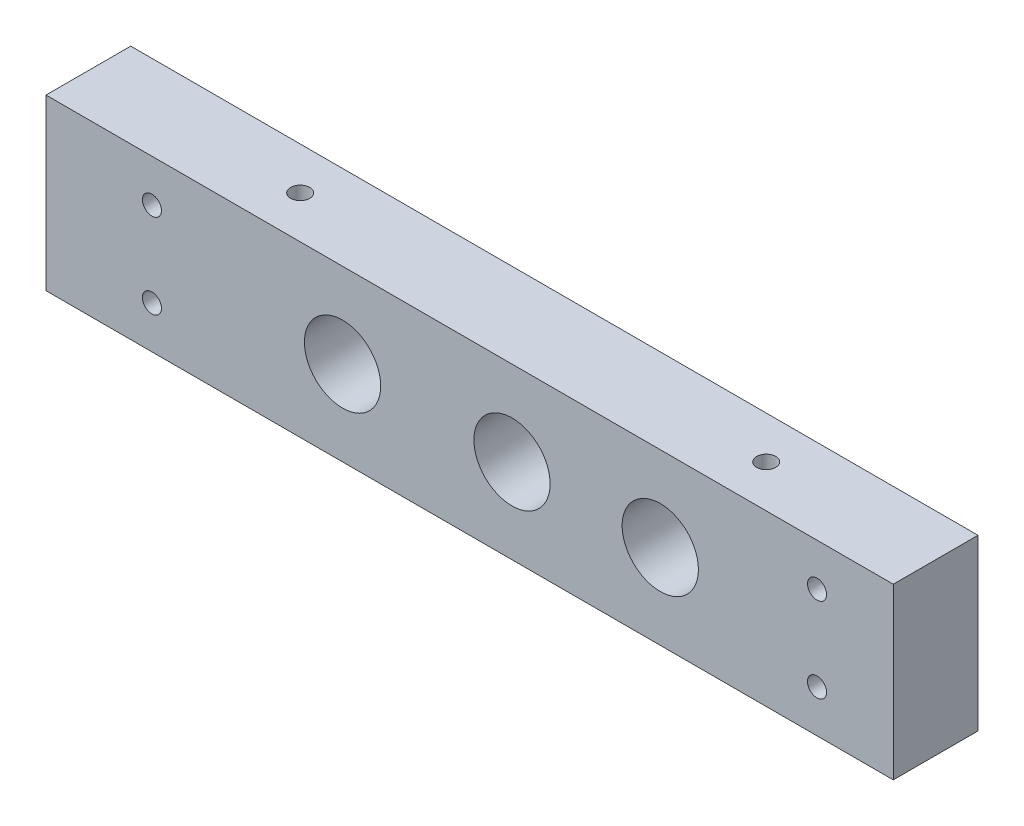
from build123d import *

# Parameters (mm, degrees)
F_200X40X20_START          = -10
SKETCH_1_W                 = 200
SKETCH_1_H                 = 40
F_200X40X20_DEPTH          = 20
CUT_EXTRUDE_321_DEPTH      = 202.246117975
CUT_EXTRUDE_321_DEPTH_BACK = 202.246117975
SKETCH_2_R                 = 9
SKETCH_2_R_2               = 2.25
CUT_EXTRUDE_M4_DEPTH       = 202.246117975
CUT_EXTRUDE_M4_DEPTH_BACK  = 202.246117975
SKETCH_3_R                 = 2.25


with BuildPart() as part:
    # 草图1 → 前臂200x40x20 (new body)
    with BuildSketch(Plane.XY.offset(F_200X40X20_START)):
        with Locations((100, 0)):
            Rectangle(SKETCH_1_W, SKETCH_1_H)
    extrude(amount=F_200X40X20_DEPTH)

    # 草图2 → Cut-Extrude 321 (cut, two sides: drawn at the far end of the back side and taken through both)
    with BuildSketch(Plane.XY.offset(-CUT_EXTRUDE_321_DEPTH_BACK)):
        with Locations((70, 0)):
            Circle(SKETCH_2_R)
        with Locations((110, 0)):
            Circle(SKETCH_2_R)
        with Locations((145, 0)):
            Circle(SKETCH_2_R)
        with Locations((25, -10)):
            Circle(SKETCH_2_R_2)
        with Locations((25, 10)):
            Circle(SKETCH_2_R_2)
        with Locations((182, -10)):
            Circle(SKETCH_2_R_2)
        with Locations((182, 10)):
            Circle(SKETCH_2_R_2)
    extrude(amount=CUT_EXTRUDE_321_DEPTH + CUT_EXTRUDE_321_DEPTH_BACK, mode=Mode.SUBTRACT)

    # 草图3 → 主板托盘竖向M4 (cut, two sides: drawn at the far end of the back side and taken through both)
    with BuildSketch(Plane(origin=(0, 0, 0), x_dir=(1, 0, 0), z_dir=(0, 1, 0)).offset(-CUT_EXTRUDE_M4_DEPTH_BACK)):
        with Locations(Location((50, 0, 0), (0, 0, 270))):
            Circle(SKETCH_3_R)
        with Locations(Location((160, 0, 0), (0, 0, 270))):
            Circle(SKETCH_3_R)
    extrude(amount=CUT_EXTRUDE_M4_DEPTH + CUT_EXTRUDE_M4_DEPTH_BACK, mode=Mode.SUBTRACT)


solid = part.part
